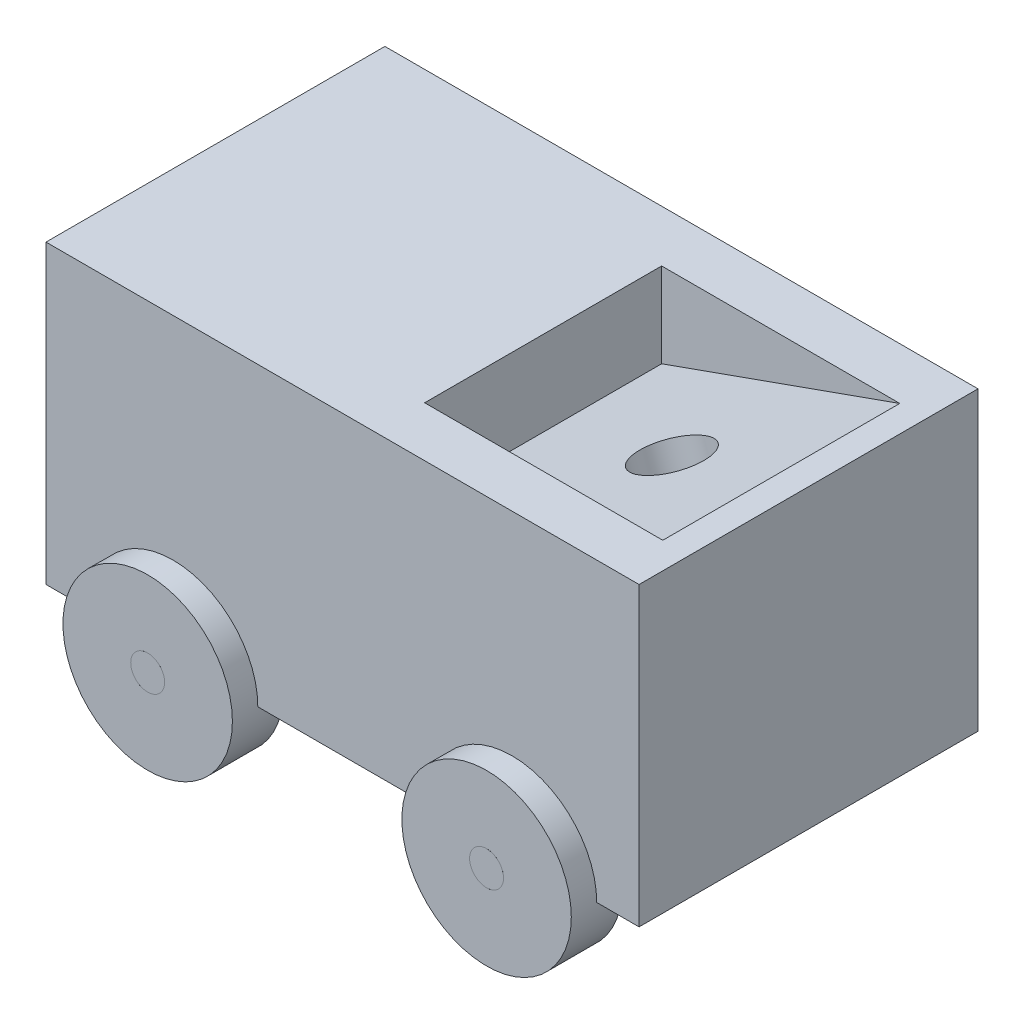
from build123d import *

# Parameters (mm, degrees)
SKETCH2_W                 = 70
SKETCH2_H                 = 35
BOSS_EXTRUDE2_DEPTH       = 40
SKETCH3_W                 = 28.105894453
SKETCH3_H                 = 27.971945797
CUT_EXTRUDE1_DEPTH        = 10
SKETCH4_R                 = 10
CUT_EXTRUDE2_DEPTH        = 3
CUT_EXTRUDE3_START        = -3
SKETCH5_R                 = 10
CUT_EXTRUDE3_DEPTH        = 3
BOSS_EXTRUDE3_DEPTH       = 3
BOSS_EXTRUDE3_DEPTH_BACK  = 3
SKETCH6_R                 = 10
SKETCH7_R                 = 10
BOSS_EXTRUDE5_DEPTH       = 6
SKETCH8_R                 = 2
CUT_EXTRUDE5_DEPTH        = 46
BOSS_EXTRUDE8_DEPTH       = 0.0001
BOSS_EXTRUDE8_DEPTH_BACK  = 46.0001
SKETCH9_R                 = 2
BOSS_EXTRUDE9_DEPTH       = 3
BOSS_EXTRUDE9_DEPTH_BACK  = 3
SKETCH10_R                = 10
BOSS_EXTRUDE10_DEPTH      = 3
BOSS_EXTRUDE10_DEPTH_BACK = 3
SKETCH11_R                = 10
SKETCH12_R                = 2
CUT_EXTRUDE6_DEPTH        = 46
BOSS_EXTRUDE11_DEPTH      = 0.001
BOSS_EXTRUDE11_DEPTH_BACK = 46.001
SKETCH13_R                = 2
BOSS_EXTRUDE12_DEPTH      = 28
SKETCH18_R                = 4
CUT_EXTRUDE11_DEPTH       = 10


with BuildPart() as part:
    # Sketch2 → Boss-Extrude2 (new body)
    with BuildSketch(Plane.XY):
        with Locations((-35, -17.5)):
            Rectangle(SKETCH2_W, SKETCH2_H)
    extrude(amount=BOSS_EXTRUDE2_DEPTH)

    # Sketch3 → Cut-Extrude1 (cut)
    with BuildSketch(Plane(origin=(0, 0, 0), x_dir=(1, 0, 0), z_dir=(0, 1, 0))):
        with Locations((-17.175677586, -20.094439992)):
            Rectangle(SKETCH3_W, SKETCH3_H)
    extrude(amount=-CUT_EXTRUDE1_DEPTH, mode=Mode.SUBTRACT)

    # Sketch4 → Cut-Extrude2 (cut)
    with BuildSketch(Plane.XY.offset(40)):
        with Locations((-15, -35)):
            Circle(SKETCH4_R)
        with Locations((-55, -35)):
            Circle(SKETCH4_R)
    extrude(amount=-CUT_EXTRUDE2_DEPTH, mode=Mode.SUBTRACT)

    # Sketch5 → Cut-Extrude3 (cut)
    with BuildSketch(Plane(origin=(0, 0, 0), x_dir=(-1, 0, 0), z_dir=(0, 0, -1)).offset(CUT_EXTRUDE3_START)):
        with Locations((15, -35)):
            Circle(SKETCH5_R)
        with Locations((55, -35)):
            Circle(SKETCH5_R)
    extrude(amount=CUT_EXTRUDE3_DEPTH, mode=Mode.SUBTRACT)

    # Sketch6 → Boss-Extrude3 (add, two sides: drawn at the far end of the back side and taken through both)
    with BuildSketch(Plane.XY.offset(40).offset(-BOSS_EXTRUDE3_DEPTH_BACK)):
        with Locations((-55, -35)):
            Circle(SKETCH6_R)
    extrude(amount=BOSS_EXTRUDE3_DEPTH + BOSS_EXTRUDE3_DEPTH_BACK)

    # Sketch7 → Boss-Extrude5 (add)
    with BuildSketch(Plane(origin=(0, 0, 3), x_dir=(-1, 0, 0), z_dir=(0, 0, -1))):
        with Locations(Location((55, -35, 0), (0, 0, 180))):
            Circle(SKETCH7_R)
    extrude(amount=BOSS_EXTRUDE5_DEPTH)

    # Sketch8 → Cut-Extrude5 (cut)
    with BuildSketch(Plane(origin=(0, 0, -3), x_dir=(-1, 0, 0), z_dir=(0, 0, -1))):
        with Locations((55, -35)):
            Circle(SKETCH8_R)
    extrude(amount=-CUT_EXTRUDE5_DEPTH, mode=Mode.SUBTRACT)

    # Sketch9 → Boss-Extrude8 (add, two sides: drawn at the far end of the back side and taken through both)
    with BuildSketch(Plane(origin=(0, 0, -3), x_dir=(-1, 0, 0), z_dir=(0, 0, -1)).offset(-BOSS_EXTRUDE8_DEPTH_BACK)):
        with Locations((55, -35)):
            Circle(SKETCH9_R)
    extrude(amount=BOSS_EXTRUDE8_DEPTH + BOSS_EXTRUDE8_DEPTH_BACK)

    # Sketch10 → Boss-Extrude9 (add, two sides: drawn at the far end of the back side and taken through both)
    with BuildSketch(Plane.XY.offset(40).offset(-BOSS_EXTRUDE9_DEPTH_BACK)):
        with Locations((-15, -35)):
            Circle(SKETCH10_R)
    extrude(amount=BOSS_EXTRUDE9_DEPTH + BOSS_EXTRUDE9_DEPTH_BACK)

    # Sketch11 → Boss-Extrude10 (add, two sides: drawn at the far end of the back side and taken through both)
    with BuildSketch(Plane(origin=(0, 0, 0), x_dir=(-1, 0, 0), z_dir=(0, 0, -1)).offset(-BOSS_EXTRUDE10_DEPTH_BACK)):
        with Locations(Location((15, -35, 0), (0, 0, 180))):
            Circle(SKETCH11_R)
    extrude(amount=BOSS_EXTRUDE10_DEPTH + BOSS_EXTRUDE10_DEPTH_BACK)

    # Sketch12 → Cut-Extrude6 (cut)
    with BuildSketch(Plane(origin=(0, 0, -3), x_dir=(-1, 0, 0), z_dir=(0, 0, -1))):
        with Locations((15, -35)):
            Circle(SKETCH12_R)
    extrude(amount=-CUT_EXTRUDE6_DEPTH, mode=Mode.SUBTRACT)

    # Sketch13 → Boss-Extrude11 (add, two sides: drawn at the far end of the back side and taken through both)
    with BuildSketch(Plane(origin=(0, 0, -3), x_dir=(-1, 0, 0), z_dir=(0, 0, -1)).offset(-BOSS_EXTRUDE11_DEPTH_BACK)):
        with Locations((15, -35)):
            Circle(SKETCH13_R)
    extrude(amount=BOSS_EXTRUDE11_DEPTH + BOSS_EXTRUDE11_DEPTH_BACK)

    # Sketch14 → Boss-Extrude12 (add)
    with BuildSketch(Plane(origin=(0, 0, 34.080412891), x_dir=(-1, 0, 0), z_dir=(0, 0, -1))):
        Polygon((3.122730359, 0), (31.228624812, -10), (3.122730359, -10), align=None)
    extrude(amount=BOSS_EXTRUDE12_DEPTH)

    # Sketch18 → Cut-Extrude11 (cut)
    with BuildSketch(Plane(origin=(-0.350891722, 0.986212569, 0), x_dir=(0.9421427910100845, 0.33521181564456864, 0), z_dir=(-0.33521181564456864, 0.9421427910100845, 0))):
        with Locations(Location((-16.374329601, -20.352535637, 0), (0, 0, 180))):
            Circle(SKETCH18_R)
    extrude(amount=-CUT_EXTRUDE11_DEPTH, mode=Mode.SUBTRACT)


solid = part.part
